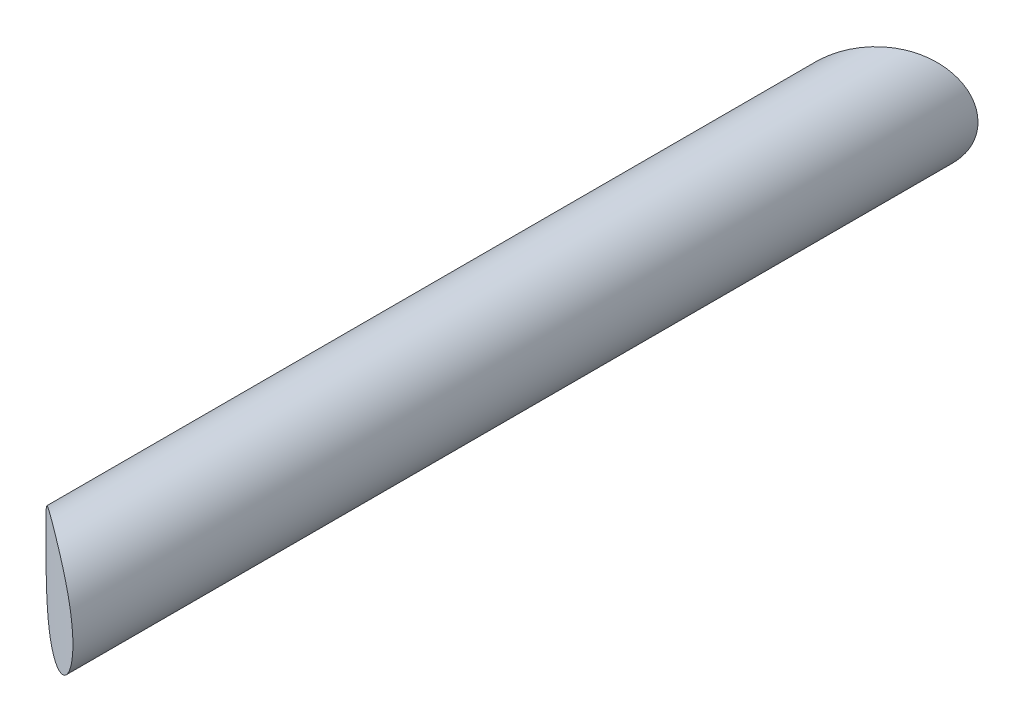
from build123d import *

# Parameters (mm, degrees)
BOSS_EXTRUDE1_DEPTH      = 12.7
BOSS_EXTRUDE1_DEPTH_BACK = 12.7
SKETCH2_R                = 1.35
CUT_EXTRUDE1_DEPTH       = 13.842702208
CUT_EXTRUDE1_DEPTH_BACK  = 13.842702208
SKETCH3_R                = 25.4
SKETCH3_R_2              = 12.7


with BuildPart() as part:
    # Sketch2 → Boss-Extrude1 (new, two sides: drawn at the far end of the back side and taken through both)
    with BuildSketch(Plane.XY.offset(-BOSS_EXTRUDE1_DEPTH_BACK)):
        Circle(SKETCH2_R)
    extrude(amount=BOSS_EXTRUDE1_DEPTH + BOSS_EXTRUDE1_DEPTH_BACK)

    # Sketch3 → Cut-Extrude1 (cut, two sides: drawn at the far end of the back side and taken through both)
    with BuildSketch(Plane(origin=(0, 0, 0), x_dir=(1, 0, 0), z_dir=(0, 1, 0)).offset(-CUT_EXTRUDE1_DEPTH_BACK)):
        with Locations((7.5946, 0)):
            Circle(SKETCH3_R)
        with Locations((7.5946, 0)):
            Circle(SKETCH3_R_2, mode=Mode.SUBTRACT)
    extrude(amount=CUT_EXTRUDE1_DEPTH + CUT_EXTRUDE1_DEPTH_BACK, mode=Mode.SUBTRACT)


solid = part.part
